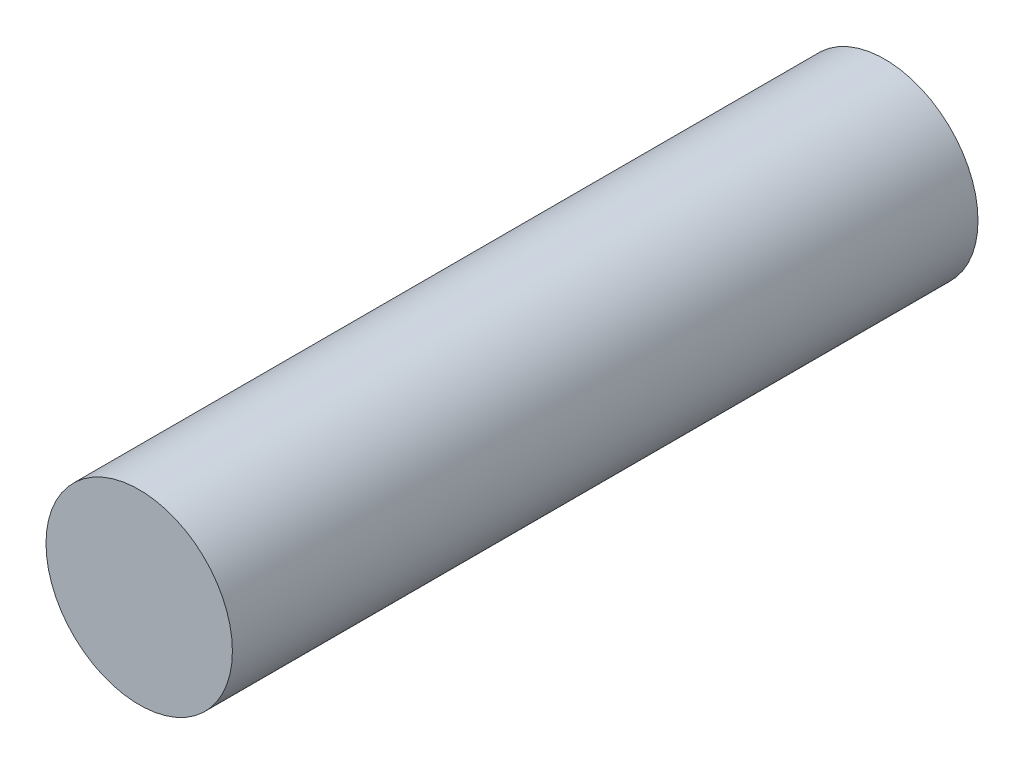
from build123d import *

# Parameters (mm, degrees)
ESQUISSE1_R        = 10
BOSS_EXTRU_1_DEPTH = 80


with BuildPart() as part:
    # Esquisse1 → Boss.-Extru.1 (new body)
    with BuildSketch(Plane.XY):
        Circle(ESQUISSE1_R)
    extrude(amount=BOSS_EXTRU_1_DEPTH)


solid = part.part
